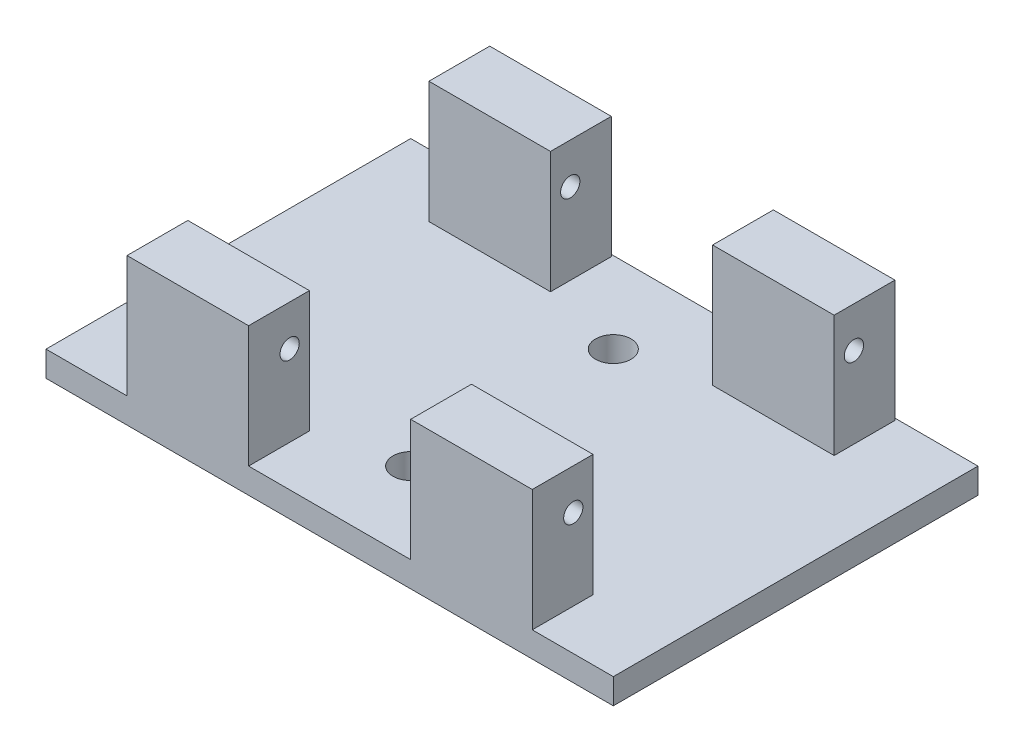
from build123d import *

# Parameters (mm, degrees)
SKETCH_1_W          = 56
SKETCH_1_H          = 36
EXTRUDE_1_DEPTH     = 2.5
SKETCH_2_W          = 12
SKETCH_2_H          = 6
EXTRUDE_2_DEPTH     = 12
SKETCH_3_R          = 0.95
CUT_EXTRUDE_1_DEPTH = 54.275228765
SKETCH_4_R          = 1.75
CUT_EXTRUDE_2_DEPTH = 36.383612026


with BuildPart() as part:
    # 草图1 → 凸台-拉伸1 (new body)
    with BuildSketch(Plane(origin=(0, 0, 0), x_dir=(1, 0, 0), z_dir=(0, 1, 0))):
        Rectangle(SKETCH_1_W, SKETCH_1_H)
    extrude(amount=EXTRUDE_1_DEPTH)

    # 草图2 → 凸台-拉伸2 (add)
    with BuildSketch(Plane(origin=(0, 2.5, 0), x_dir=(1, 0, 0), z_dir=(0, 1, 0))):
        with Locations((14, 14.8)):
            Rectangle(SKETCH_2_W, SKETCH_2_H)
        with Locations((14, -15)):
            Rectangle(SKETCH_2_W, SKETCH_2_H)
    extrude_2 = extrude(amount=EXTRUDE_2_DEPTH)

    # 草图3 → 切除-拉伸1 (cut, through all)
    with BuildSketch(Plane(origin=(20, 0, 0), x_dir=(0, 0, -1), z_dir=(1, 0, 0))):
        with Locations((-13.95, 10.5)):
            Circle(SKETCH_3_R)
        with Locations((13.75, 10.5)):
            Circle(SKETCH_3_R)
    cut_extrude_1 = extrude(amount=-CUT_EXTRUDE_1_DEPTH, mode=Mode.SUBTRACT)

    # 镜向1: 凸台-拉伸2, 切除-拉伸1 across plane
    add(extrude_2.mirror(Plane(origin=(0, 0, 0), x_dir=(0, 0, 1), z_dir=(1, 0, 0))))
    add(cut_extrude_1.mirror(Plane(origin=(0, 0, 0), x_dir=(0, 0, 1), z_dir=(1, 0, 0))), mode=Mode.SUBTRACT)

    # 草图4 → 切除-拉伸2 (cut, through all)
    with BuildSketch(Plane(origin=(0, 2.5, 0), x_dir=(1, 0, 0), z_dir=(0, 1, 0))):
        with Locations(Location((0, -10, 0), (0, 0, 270))):
            Circle(SKETCH_4_R)
        with Locations(Location((0, 10, 0), (0, 0, 270))):
            Circle(SKETCH_4_R)
    extrude(amount=-CUT_EXTRUDE_2_DEPTH, mode=Mode.SUBTRACT)


solid = part.part
